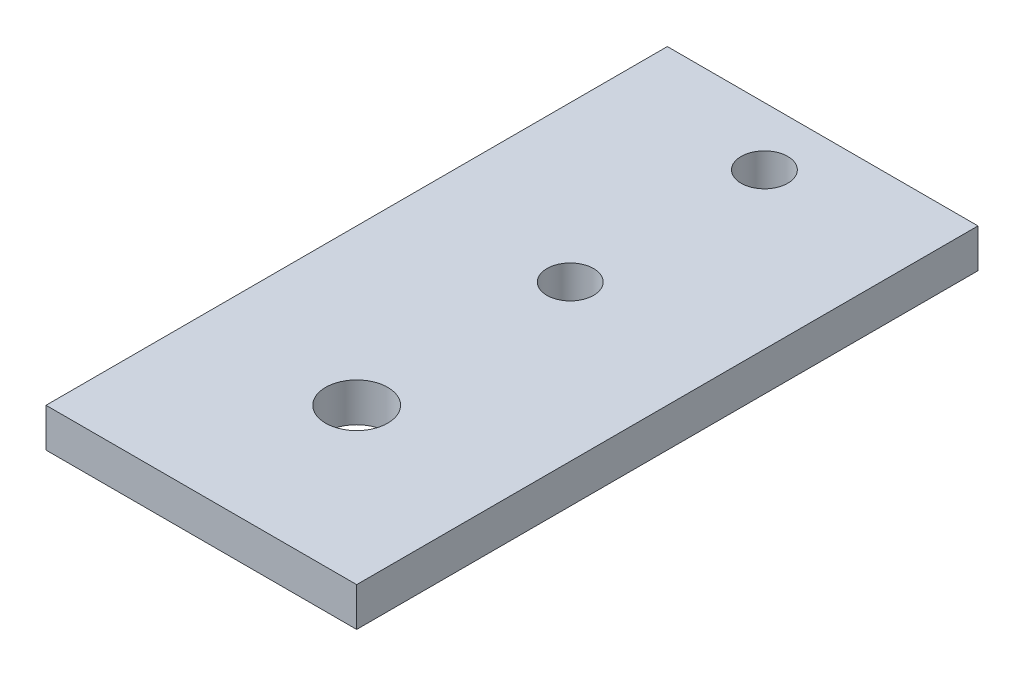
from build123d import *

# Parameters (mm, degrees)
SKETCH1_W           = 40
SKETCH1_H           = 80
SKETCH1_R           = 3
SKETCH1_R_2         = 4
BOSS_EXTRUDE1_DEPTH = 5


with BuildPart() as part:
    # Sketch1 → Boss-Extrude1 (new body)
    with BuildSketch(Plane(origin=(0, 0, 0), x_dir=(1, 0, 0), z_dir=(0, 1, 0))):
        with Locations((20, 40)):
            Rectangle(SKETCH1_W, SKETCH1_H)
        with Locations(Location((20, 72.5, 0), (0, 0, 270))):
            Circle(SKETCH1_R, mode=Mode.SUBTRACT)
        with Locations(Location((20, 47.5, 0), (0, 0, 270))):
            Circle(SKETCH1_R, mode=Mode.SUBTRACT)
        with Locations(Location((20, 20, 0), (0, 0, 270))):
            Circle(SKETCH1_R_2, mode=Mode.SUBTRACT)
    extrude(amount=BOSS_EXTRUDE1_DEPTH)


solid = part.part
